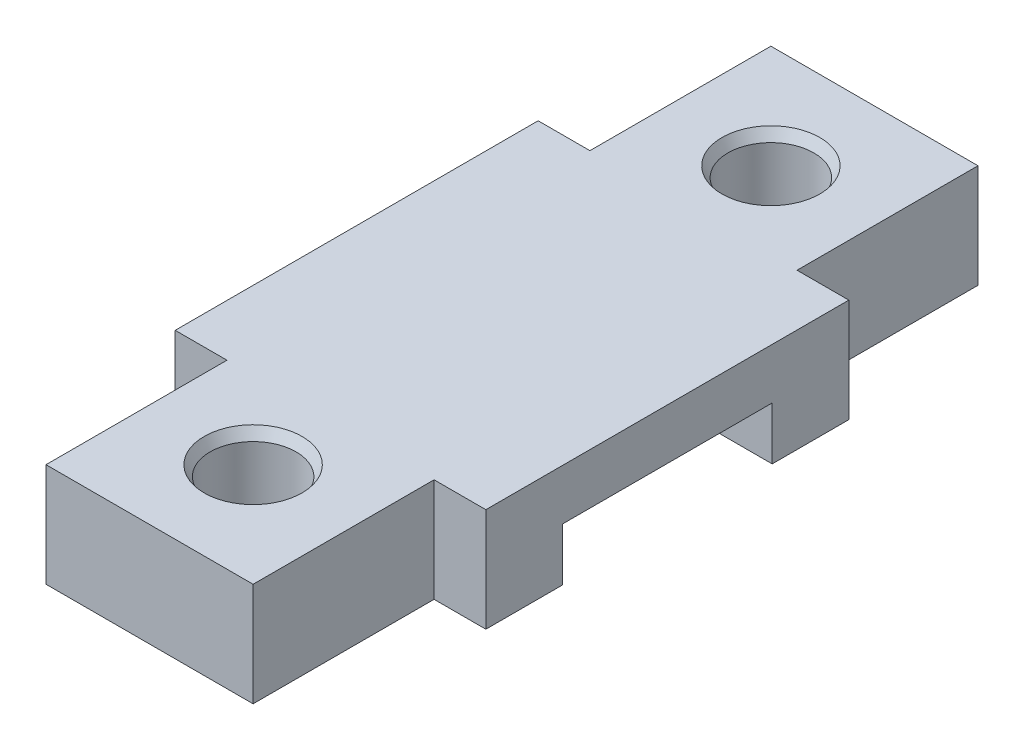
from build123d import *
from OCP.BRepFilletAPI import BRepFilletAPI_MakeChamfer

# Parameters (mm, degrees)
SKETCH1_W                = 20
SKETCH1_H                = 70
BOSS_EXTRUDE1_DEPTH      = 10
CUT_EXTRUDE1_DEPTH       = 42.533119315
CUT_EXTRUDE1_DEPTH_BACK  = 42.533119315
SKETCH2_W                = 20.25
SKETCH2_H                = 5.1
SKETCH3_R                = 4.15
CUT_EXTRUDE2_DEPTH       = 38.749172176
BOSS_EXTRUDE2_DEPTH      = 5
BOSS_EXTRUDE2_DEPTH_BACK = 25
CHAMFER1_SIZE            = 1
CHAMFER1_SIZE2           = 0.577350269


with BuildPart() as part:
    # Sketch1 → Boss-Extrude1 (new body)
    with BuildSketch(Plane(origin=(0, 0, 0), x_dir=(1, 0, 0), z_dir=(0, 1, 0))):
        Rectangle(SKETCH1_W, SKETCH1_H)
    extrude(amount=BOSS_EXTRUDE1_DEPTH)

    # Sketch2 → Cut-Extrude1 (cut, two sides: drawn at the far end of the back side and taken through both)
    with BuildSketch(Plane(origin=(10, 0, 0), x_dir=(0, 0, -1), z_dir=(1, 0, 0)).offset(-CUT_EXTRUDE1_DEPTH_BACK)):
        with Locations((0, 2.55)):
            Rectangle(SKETCH2_W, SKETCH2_H)
    extrude(amount=CUT_EXTRUDE1_DEPTH + CUT_EXTRUDE1_DEPTH_BACK, mode=Mode.SUBTRACT)

    # Sketch3 → Cut-Extrude2 (cut, through all)
    with BuildSketch(Plane.XZ):
        with Locations(Location((0, 25, 0), (0, 0, 270))):
            Circle(SKETCH3_R)
        with Locations(Location((0, -25, 0), (0, 0, 270))):
            Circle(SKETCH3_R)
    extrude(amount=-CUT_EXTRUDE2_DEPTH, mode=Mode.SUBTRACT)

    # Sketch4 → Boss-Extrude2 (add, two sides: drawn at the far end of the back side and taken through both)
    with BuildSketch(Plane(origin=(10, 0, 0), x_dir=(0, 0, -1), z_dir=(1, 0, 0)).offset(-BOSS_EXTRUDE2_DEPTH_BACK)):
        Polygon((-10.125, 0), (-17.525, 0), (-17.525, 10), (17.525, 10), (17.525, 0), (10.125, 0), (10.125, 5.1), (-10.125, 5.1), align=None)
    extrude(amount=BOSS_EXTRUDE2_DEPTH + BOSS_EXTRUDE2_DEPTH_BACK)

    # Chamfer1: one chamfer whose edges measure the first distance from different faces: ONE call of the kernel's chamfer builder (chamfer() names one face for all edges)
    chamfer1_edges_1 = [part.edges().sort_by_distance(p)[0] for p in [
        (0, 10, 29.15),
    ]]
    chamfer1_side_1 = [part.faces().sort_by_distance(p)[0] for p in [
        (0, 5, 29.15),
    ]]
    chamfer1_edges_2 = [part.edges().sort_by_distance(p)[0] for p in [
        (0, 10, -20.85),
    ]]
    chamfer1_side_2 = [part.faces().sort_by_distance(p)[0] for p in [
        (0, 5, -20.85),
    ]]
    chamfer1 = BRepFilletAPI_MakeChamfer(part.part.solid().wrapped)
    for e in chamfer1_edges_1:
        chamfer1.Add(CHAMFER1_SIZE, CHAMFER1_SIZE2, e.wrapped, chamfer1_side_1[0].wrapped)  # the first distance lies on this face
    for e in chamfer1_edges_2:
        chamfer1.Add(CHAMFER1_SIZE, CHAMFER1_SIZE2, e.wrapped, chamfer1_side_2[0].wrapped)  # the first distance lies on this face
    add(Compound.cast(chamfer1.Shape()), mode=Mode.REPLACE)


solid = part.part
